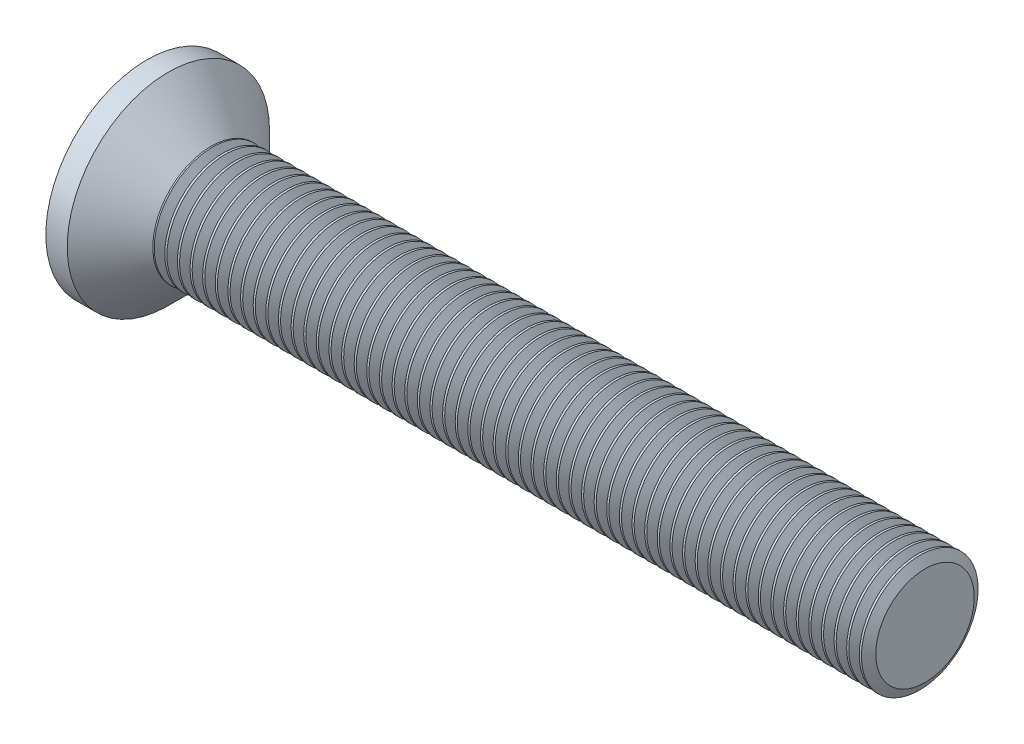
from build123d import *

# Parameters (mm, degrees)
CROSSRECESS_DEPTH = 0.825
DRAFT9_ANGLE      = 30
FILLET5_R         = 0.3
SKETCH10_W        = 0.5
SKETCH10_H        = 1.5
LPATTERN10_COUNT  = 57
LPATTERN10_PITCH  = 0.3246


with BuildPart() as part:
    # Sketch1 → Base (revolve)
    with BuildSketch(Plane.XY, mode=Mode.PRIVATE) as base_sk:
        Polygon((20, 1.5), (2.65, 1.5), (1.65, 1.5), (0.55, 2.6), (0, 2.6), (0, 0), (20, 0), align=None)
    revolve(base_sk.sketch.rotate(Axis((4.515812911, 0, 0), (-1, 0, 0)), 90), axis=Axis((4.515812911, 0, 0), (-1, 0, 0)))

    # Sketch6 → CrossRecess (cut)
    with BuildSketch(Plane(origin=(0, 0, 0), x_dir=(0, 0, -1), z_dir=(1, 0, 0))):
        Polygon((0.32, 0.32), (0.32, 1.6), (-0.32, 1.6), (-0.32, 0.32), (-1.6, 0.32), (-1.6, -0.32), (-0.32, -0.32), (-0.32, -1.6), (0.32, -1.6), (0.32, -0.32), (1.6, -0.32), (1.6, 0.32), align=None)
    extrude(amount=CROSSRECESS_DEPTH, mode=Mode.SUBTRACT)

    # Draft9
    draft9_faces = [part.faces().sort_by_distance(p)[0] for p in [
        (0.4125, -1.6, 0),
        (0.4125, 0, 1.6),
        (0.4125, 0, -1.6),
        (0.4125, 1.6, 0),
    ]]
    draft(draft9_faces, Plane(origin=(0, 2.6, 0), x_dir=(0, 0, -1), z_dir=(-1, 0, 0)), DRAFT9_ANGLE)

    # Fillet5
    fillet5_edges = [part.edges().sort_by_distance(p)[0] for p in [
        (0.4125, 0.32, 0.32),
        (0.4125, -0.32, 0.32),
        (0.4125, -0.32, -0.32),
        (0.4125, 0.32, -0.32),
    ]]
    fillet(fillet5_edges, radius=FILLET5_R)

    # Sketch10 → Revolve2 (revolve)
    with BuildSketch(Plane.XY):
        with Locations((1.9, 0.75)):
            Rectangle(SKETCH10_W, SKETCH10_H)
    revolve(axis=Axis((62.228915663, 0, 0), (-1, 0, 0)))

    # Sketch11 → Cut-Revolve10 (revolve, cut)
    with BuildSketch(Plane.XY, mode=Mode.PRIVATE) as cut_revolve10_sk:
        Polygon((20, 1.265740128), (20.13525, 1.5), (20.13525, 1.7705), (19.86475, 1.7705), (19.86475, 1.5), align=None)
    cut_revolve10 = revolve(cut_revolve10_sk.sketch.rotate(Axis((0, 0, 0), (1, 0, 0)), 270), axis=Axis((0, 0, 0), (1, 0, 0)), mode=Mode.SUBTRACT)

    # LPattern10: Cut-Revolve10 ×57
    with Locations(*[(-i * LPATTERN10_PITCH, 0, 0) for i in range(1, LPATTERN10_COUNT)]):
        add(cut_revolve10, mode=Mode.SUBTRACT)


solid = part.part
